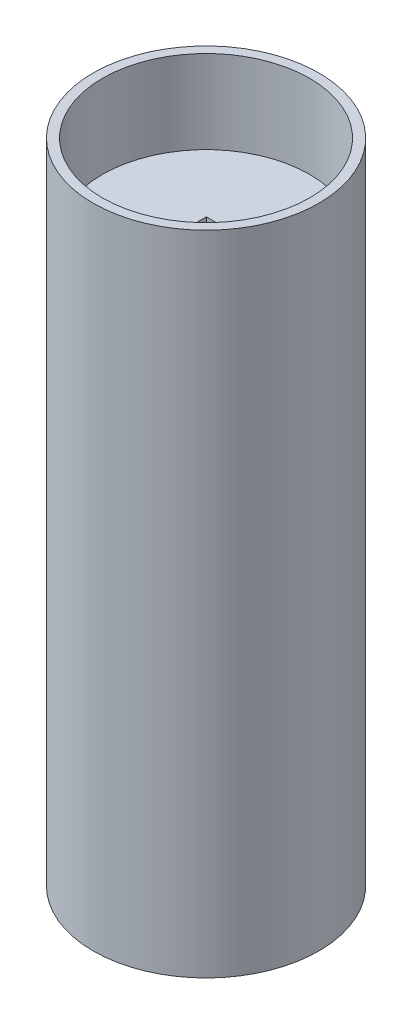
from build123d import *

# Parameters (mm, degrees)
SKETCH1_R           = 61
SKETCH1_R_2         = 56
BOSS_EXTRUDE1_DEPTH = 300
SKETCH3_R           = 56
BOSS_EXTRUDE2_DEPTH = 5
SKETCH5_R           = 56
BOSS_EXTRUDE3_DEPTH = 5
SKETCH6_W           = 16.15
SKETCH6_H           = 16.43
CUT_EXTRUDE2_DEPTH  = 5
BOSS_EXTRUDE4_START = -50
SKETCH1_3_R         = 61
SKETCH1_3_R_2       = 56
BOSS_EXTRUDE4_DEPTH = 50


with BuildPart() as part:
    # Sketch1 → Boss-Extrude1 (new body)
    with BuildSketch(Plane(origin=(0, 0, 0), x_dir=(1, 0, 0), z_dir=(0, 1, 0))):
        with Locations(Location((0, 0, 0), (0, 0, 270))):
            Circle(SKETCH1_R)
        with Locations(Location((0, 0, 0), (0, 0, 270))):
            Circle(SKETCH1_R_2, mode=Mode.SUBTRACT)
    extrude(amount=BOSS_EXTRUDE1_DEPTH)

    # Sketch5 → Boss-Extrude3 (add)
    with BuildSketch(Plane(origin=(0, 250, 0), x_dir=(1, 0, 0), z_dir=(0, 1, 0))):
        with Locations(Location((0, 0, 0), (0, 0, 270))):
            Circle(SKETCH5_R)
    extrude(amount=BOSS_EXTRUDE3_DEPTH)

    # Sketch6 → Cut-Extrude2 (cut)
    with BuildSketch(Plane(origin=(0, 255, 0), x_dir=(1, 0, 0), z_dir=(0, 1, 0))):
        Rectangle(SKETCH6_W, SKETCH6_H)
    extrude(amount=-CUT_EXTRUDE2_DEPTH, mode=Mode.SUBTRACT)

    # Sketch1<3> → Boss-Extrude4 (add)
    with BuildSketch(Plane(origin=(0, 0, 0), x_dir=(1, 0, 0), z_dir=(0, 1, 0)).offset(BOSS_EXTRUDE4_START)):
        with Locations(Location((0, 0, 0), (0, 0, 270))):
            Circle(SKETCH1_3_R)
        with Locations(Location((0, 0, 0), (0, 0, 270))):
            Circle(SKETCH1_3_R_2, mode=Mode.SUBTRACT)
    extrude(amount=BOSS_EXTRUDE4_DEPTH)


with BuildPart() as body_2:
    # Sketch3 → Boss-Extrude2 (new body)
    with BuildSketch(Plane(origin=(0, -20, 0), x_dir=(1, 0, 0), z_dir=(0, 1, 0))):
        with Locations(Location((0, 0, 0), (0, 0, 270))):
            Circle(SKETCH3_R)
    extrude(amount=BOSS_EXTRUDE2_DEPTH)


solid = Compound([part.part, body_2.part])
